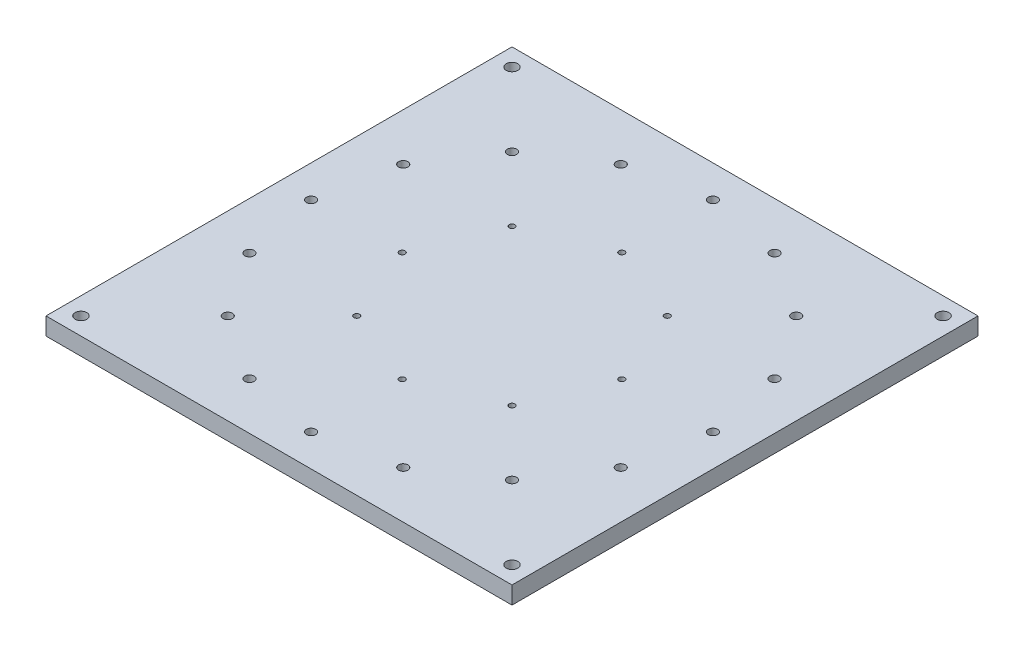
from build123d import *

# Parameters (mm, degrees)
SKETCH1_W           = 800
SKETCH1_H           = 800
BOSS_EXTRUDE1_DEPTH = 15
SKETCH2_R           = 5
CUT_EXTRUDE1_DEPTH  = 15
SKETCH4_R           = 8
CUT_EXTRUDE2_DEPTH  = 15
SKETCH5_R           = 10
CUT_EXTRUDE3_DEPTH  = 567.480361531


with BuildPart() as part:
    # Sketch1 → Boss-Extrude1 (new, symmetric)
    with BuildSketch(Plane(origin=(0, 0, 0), x_dir=(1, 0, 0), z_dir=(0, 1, 0))):
        Rectangle(SKETCH1_W, SKETCH1_H)
    extrude(amount=BOSS_EXTRUDE1_DEPTH, both=True)

    # Sketch2 → Cut-Extrude1 (cut)
    with BuildSketch(Plane(origin=(0, 15, 0), x_dir=(1, 0, 0), z_dir=(0, 1, 0))):
        with Locations(Location((0, 188.5, 0), (0, 0, 270))):
            Circle(SKETCH2_R)
        with Locations(Location((188.5, 0, 0), (0, 0, 270))):
            Circle(SKETCH2_R)
        with Locations(Location((0, -188.5, 0), (0, 0, 90))):
            Circle(SKETCH2_R)
        with Locations(Location((-188.5, 0, 0), (0, 0, 90))):
            Circle(SKETCH2_R)
        with Locations(Location((133.289628254, 133.289628254, 0), (0, 0, 270))):
            Circle(SKETCH2_R)
        with Locations(Location((-133.289628254, -133.289628254, 0), (0, 0, 90))):
            Circle(SKETCH2_R)
        with Locations(Location((133.289628254, -133.289628254, 0), (0, 0, 270))):
            Circle(SKETCH2_R)
        with Locations(Location((-133.289628254, 133.289628254, 0), (0, 0, 90))):
            Circle(SKETCH2_R)
    extrude(amount=-CUT_EXTRUDE1_DEPTH, mode=Mode.SUBTRACT)

    # Sketch4 → Cut-Extrude2 (cut)
    with BuildSketch(Plane(origin=(0, 15, 0), x_dir=(1, 0, 0), z_dir=(0, 1, 0))):
        with Locations(Location((0, 345, 0), (0, 0, 270))):
            Circle(SKETCH4_R)
        with Locations(Location((132.025784166, 318.738438716, 0), (0, 0, 270))):
            Circle(SKETCH4_R)
        with Locations(Location((243.951839509, 243.951839509, 0), (0, 0, 270))):
            Circle(SKETCH4_R)
        with Locations(Location((318.738438716, 132.025784166, 0), (0, 0, 270))):
            Circle(SKETCH4_R)
        with Locations(Location((345, 0, 0), (0, 0, 270))):
            Circle(SKETCH4_R)
        with Locations(Location((318.738438716, -132.025784166, 0), (0, 0, 270))):
            Circle(SKETCH4_R)
        with Locations(Location((243.951839509, -243.951839509, 0), (0, 0, 270))):
            Circle(SKETCH4_R)
        with Locations(Location((132.025784166, -318.738438716, 0), (0, 0, 270))):
            Circle(SKETCH4_R)
        with Locations(Location((0, -345, 0), (0, 0, 270))):
            Circle(SKETCH4_R)
        with Locations(Location((-132.025784166, -318.738438716, 0), (0, 0, 270))):
            Circle(SKETCH4_R)
        with Locations(Location((-243.951839509, -243.951839509, 0), (0, 0, 270))):
            Circle(SKETCH4_R)
        with Locations(Location((-318.738438716, -132.025784166, 0), (0, 0, 270))):
            Circle(SKETCH4_R)
        with Locations(Location((-345, 0, 0), (0, 0, 270))):
            Circle(SKETCH4_R)
        with Locations(Location((-318.738438716, 132.025784166, 0), (0, 0, 270))):
            Circle(SKETCH4_R)
        with Locations(Location((-243.951839509, 243.951839509, 0), (0, 0, 270))):
            Circle(SKETCH4_R)
        with Locations(Location((-132.025784166, 318.738438716, 0), (0, 0, 270))):
            Circle(SKETCH4_R)
    extrude(amount=-CUT_EXTRUDE2_DEPTH, mode=Mode.SUBTRACT)

    # Sketch5 → Cut-Extrude3 (cut, through all)
    with BuildSketch(Plane(origin=(0, 15, 0), x_dir=(1, 0, 0), z_dir=(0, 1, 0))):
        with Locations(Location((-370, 370, 0), (0, 0, 270))):
            Circle(SKETCH5_R)
        with Locations(Location((370, 370, 0), (0, 0, 90))):
            Circle(SKETCH5_R)
        with Locations(Location((370, -370, 0), (0, 0, 270))):
            Circle(SKETCH5_R)
        with Locations(Location((-370, -370, 0), (0, 0, 90))):
            Circle(SKETCH5_R)
    extrude(amount=-CUT_EXTRUDE3_DEPTH, mode=Mode.SUBTRACT)


solid = part.part
